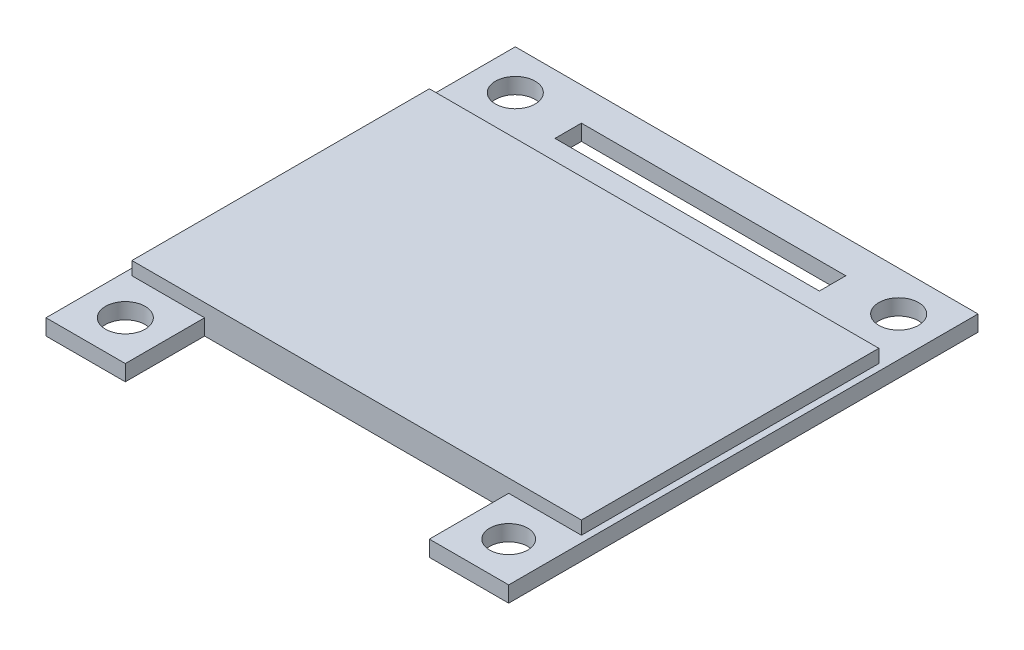
from build123d import *

# Parameters (mm, degrees)
SKETCH1_R           = 1.5
SKETCH1_W           = 20
SKETCH1_H           = 2
SKETCH1_R_2         = 1.439670622
BOSS_EXTRUDE3_DEPTH = 1.2
BOSS_EXTRUDE4_DEPTH = 2.2


with BuildPart() as part:
    # Sketch1 → Boss-Extrude3 (new body)
    with BuildSketch(Plane(origin=(0, 0, 0), x_dir=(1, 0, 0), z_dir=(0, 1, 0))):
        Polygon((0, 29.5), (0, -6), (6, -6), (6, 0), (0.5, 0), (0.5, 22.5), (34.5, 22.5), (34.5, 0), (29, 0), (29, -6), (35, -6), (35, 29.5), align=None)
        with Locations((3, 26.5)):
            Circle(SKETCH1_R, mode=Mode.SUBTRACT)
        with Locations((17.5, 26)):
            Rectangle(SKETCH1_W, SKETCH1_H, mode=Mode.SUBTRACT)
        with Locations((32, 26.5)):
            Circle(SKETCH1_R, mode=Mode.SUBTRACT)
        with Locations((32, -3)):
            Circle(SKETCH1_R_2, mode=Mode.SUBTRACT)
        with Locations((3, -3)):
            Circle(SKETCH1_R, mode=Mode.SUBTRACT)
    extrude(amount=BOSS_EXTRUDE3_DEPTH)

    # Sketch1<7> → Boss-Extrude4 (add)
    with BuildSketch(Plane(origin=(0, 0, 0), x_dir=(1, 0, 0), z_dir=(0, 1, 0))):
        Polygon((0.5, 22.5), (0.5, 0), (6, 0), (29, 0), (34.5, 0), (34.5, 22.5), align=None)
    extrude(amount=BOSS_EXTRUDE4_DEPTH)


solid = part.part
